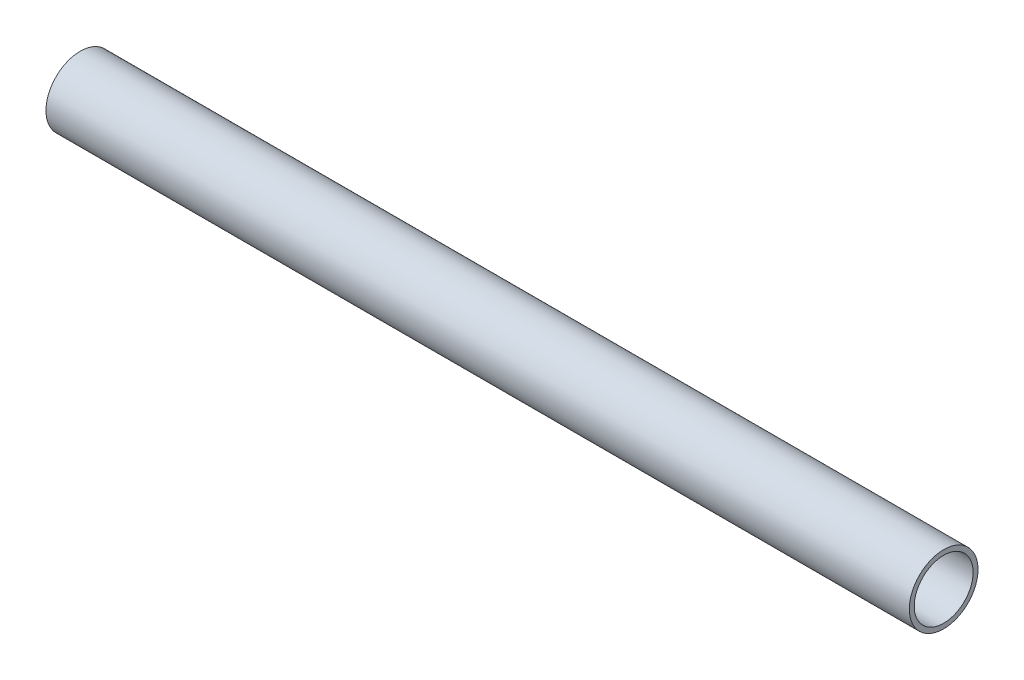
from build123d import *

# Parameters (mm, degrees)
SKETCH1_R           = 11.1125
SKETCH1_R_2         = 9.525
BOSS_EXTRUDE1_DEPTH = 139.7


with BuildPart() as part:
    # Sketch1 → Boss-Extrude1 (new, symmetric)
    with BuildSketch(Plane(origin=(0, 0, 0), x_dir=(0, 0, -1), z_dir=(1, 0, 0))):
        Circle(SKETCH1_R)
        Circle(SKETCH1_R_2, mode=Mode.SUBTRACT)
    extrude(amount=BOSS_EXTRUDE1_DEPTH, both=True)


solid = part.part
